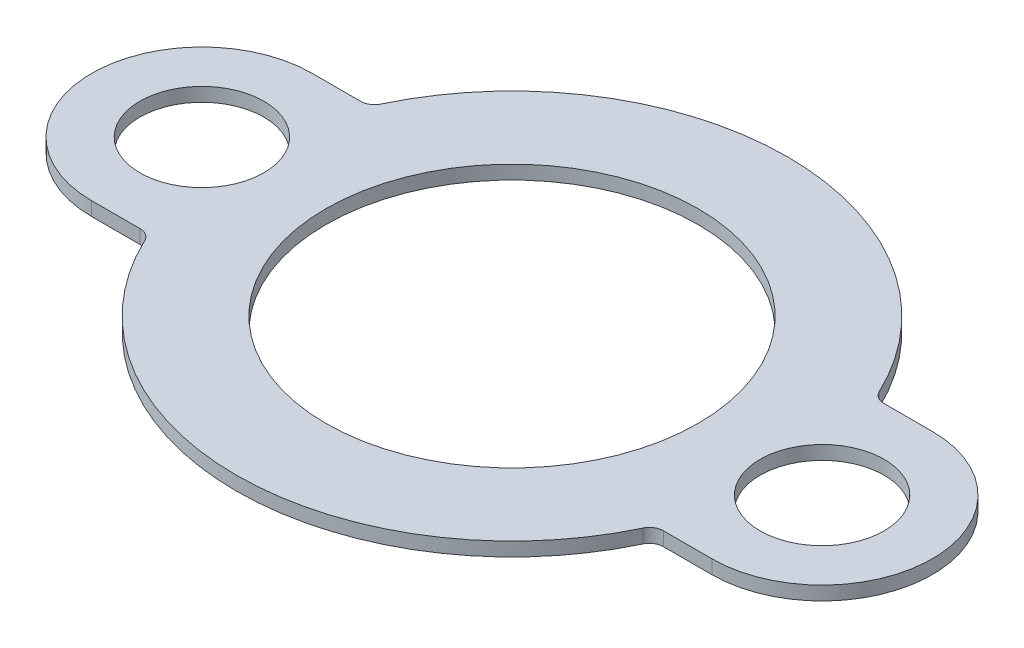
from build123d import *

# Parameters (mm, degrees)
SKETCH_1_R      = 13.5
SKETCH_1_R_2    = 4.5
EXTRUDE_1_DEPTH = 1


with BuildPart() as part:
    # 草圖1 → 伸長1 (new body)
    with BuildSketch(Plane(origin=(0, 0, 0), x_dir=(1, 0, 0), z_dir=(0, 1, 0))):
        with BuildLine():
            Line((18.973665961, 8), (22.5, 8))
            ThreePointArc((22.5, 8), (30.5, 0), (22.5, -8))
            Line((22.5, -8), (18.973665961, -8))
            ThreePointArc((18.973665961, -8), (18.439143477, -8.154845745), (18.070158058, -8.571428571))
            ThreePointArc((18.070158058, -8.571428571), (0, -20), (-18.070158058, -8.571428571))
            ThreePointArc((-18.070158058, -8.571428571), (-18.439143477, -8.154845745), (-18.973665961, -8))
            Line((-18.973665961, -8), (-22.5, -8))
            ThreePointArc((-22.5, -8), (-30.5, 0), (-22.5, 8))
            Line((-22.5, 8), (-18.973665961, 8))
            ThreePointArc((-18.973665961, 8), (-18.439143477, 8.154845745), (-18.070158058, 8.571428571))
            ThreePointArc((-18.070158058, 8.571428571), (0, 20), (18.070158058, 8.571428571))
            ThreePointArc((18.070158058, 8.571428571), (18.439143477, 8.154845745), (18.973665961, 8))
        make_face()
        with Locations(Location((0, 0, 0), (0, 0, 270))):
            Circle(SKETCH_1_R, mode=Mode.SUBTRACT)
        with Locations(Location((22.5, 0, 0), (0, 0, 270))):
            Circle(SKETCH_1_R_2, mode=Mode.SUBTRACT)
        with Locations(Location((-22.5, 0, 0), (0, 0, 90))):
            Circle(SKETCH_1_R_2, mode=Mode.SUBTRACT)
    extrude(amount=EXTRUDE_1_DEPTH)


solid = part.part
